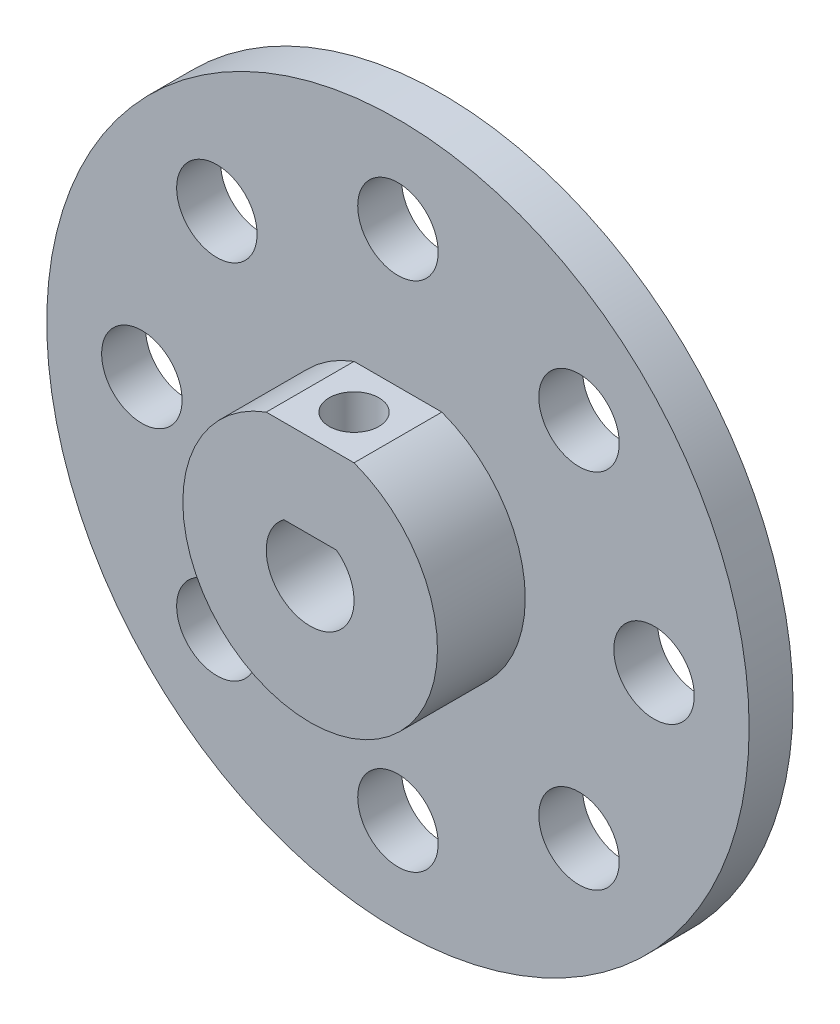
from build123d import *

# Parameters (mm, degrees)
CORTAR_EXTRUIR1_DEPTH            = 10
TALADRO_DE_MARGEN_PARA_M51_D     = 5.5
CORTAR_EXTRUIR2_DEPTH            = 6
TALADRO_DE_MARGEN_PARA_M31_D     = 3.4
TALADRO_DE_MARGEN_PARA_M31_DEPTH = 5.766394553


with BuildPart() as part:
    # Croquis1 → Revolución1 (revolve)
    with BuildSketch(Plane(origin=(0, 0, 0), x_dir=(0, 0, -1), z_dir=(1, 0, 0)), mode=Mode.PRIVATE) as revoluci_n1_sk:
        Polygon((-5.25, 0), (5.25, 0), (5.25, 9), (3.75, 9), (3.75, 24), (0.75, 24), (0.75, 8.7), (-5.25, 8.7), align=None)
    revolve(revoluci_n1_sk.sketch.rotate(Axis((0, 0, 25.623234534), (0, 0, -1)), 90), axis=Axis((0, 0, 25.623234534), (0, 0, -1)))

    # Croquis2 → Cortar-Extruir1 (cut)
    with BuildSketch(Plane.XY.offset(5.25)):
        with BuildLine():
            Line((-1.8, 2.4), (1.8, 2.4))
            ThreePointArc((1.8, 2.4), (0, -3), (-1.8, 2.4))
        make_face()
    extrude(amount=-CORTAR_EXTRUIR1_DEPTH, mode=Mode.SUBTRACT)

    # Taladro de margen para M51 (through all)
    with Locations(Plane(origin=(0, 17.5, -3.75), x_dir=(-1, 0, 0), z_dir=(0, 0, -1))):
        with Locations((0, 0), (12.374368671, -5.125631329), (17.5, -17.5), (12.374368671, -29.874368671), (0, -35), (-12.374368671, -29.874368671), (-17.5, -17.5), (-12.374368671, -5.125631329)):
            Hole(TALADRO_DE_MARGEN_PARA_M51_D / 2)

    # Croquis10 → Cortar-Extruir2 (cut)
    with BuildSketch(Plane.XY.offset(5.25)):
        with BuildLine():
            Line((-3, 8.166394553), (3, 8.166394553))
            ThreePointArc((3, 8.166394553), (0, 8.7), (-3, 8.166394553))
        make_face()
    extrude(amount=-CORTAR_EXTRUIR2_DEPTH, mode=Mode.SUBTRACT)

    # Taladro de margen para M31
    with Locations(Plane(origin=(0, 8.166394553, 2.25), x_dir=(0, 0, 1), z_dir=(0, 1, 0))):
        with Locations((0, 0)):
            Hole(TALADRO_DE_MARGEN_PARA_M31_D / 2, depth=TALADRO_DE_MARGEN_PARA_M31_DEPTH)


solid = part.part
